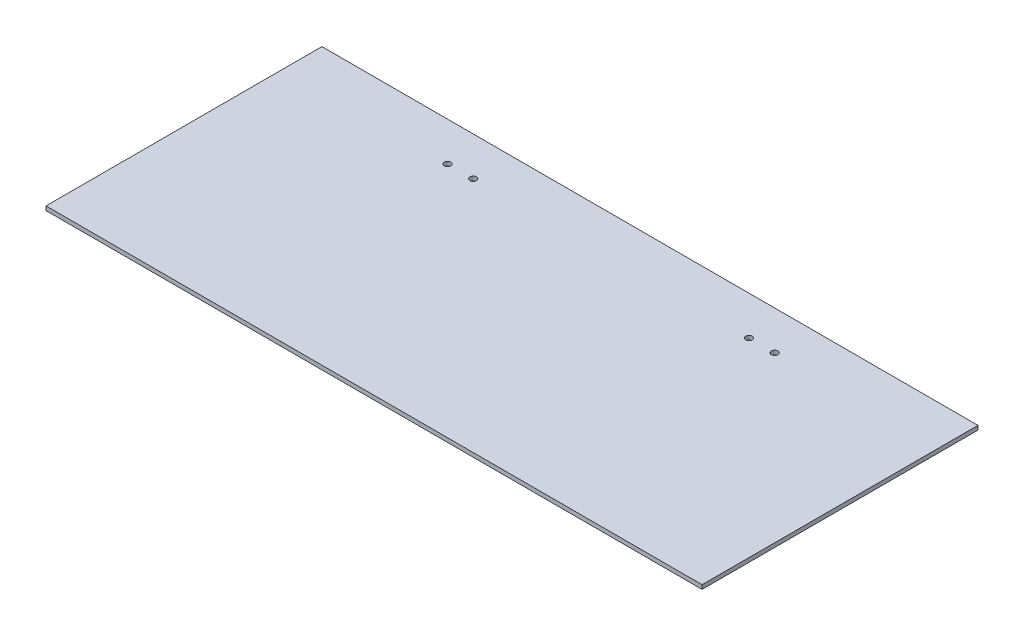
from build123d import *

# Parameters (mm, degrees)
SKETCH1_W           = 509.5875
SKETCH1_H           = 214.3125
BOSS_EXTRUDE1_DEPTH = 3.175
SKETCH2_R           = 2.54
CUT_EXTRUDE1_DEPTH  = 3.175


with BuildPart() as part:
    # Sketch1 → Boss-Extrude1 (new body)
    with BuildSketch(Plane(origin=(0, 0, 0), x_dir=(1, 0, 0), z_dir=(0, 1, 0))):
        Rectangle(SKETCH1_W, SKETCH1_H)
    extrude(amount=BOSS_EXTRUDE1_DEPTH)

    # Sketch2 → Cut-Extrude1 (cut)
    with BuildSketch(Plane(origin=(0, 3.175, 0), x_dir=(1, 0, 0), z_dir=(0, 1, 0))):
        with Locations(Location((-127, 76.99375, 0), (0, 0, 270))):
            Circle(SKETCH2_R)
        with Locations(Location((-107.15625, 76.99375, 0), (0, 0, 270))):
            Circle(SKETCH2_R)
        with Locations(Location((107.15625, 76.99375, 0), (0, 0, 270))):
            Circle(SKETCH2_R)
        with Locations(Location((127, 76.99375, 0), (0, 0, 270))):
            Circle(SKETCH2_R)
    extrude(amount=-CUT_EXTRUDE1_DEPTH, mode=Mode.SUBTRACT)


solid = part.part
